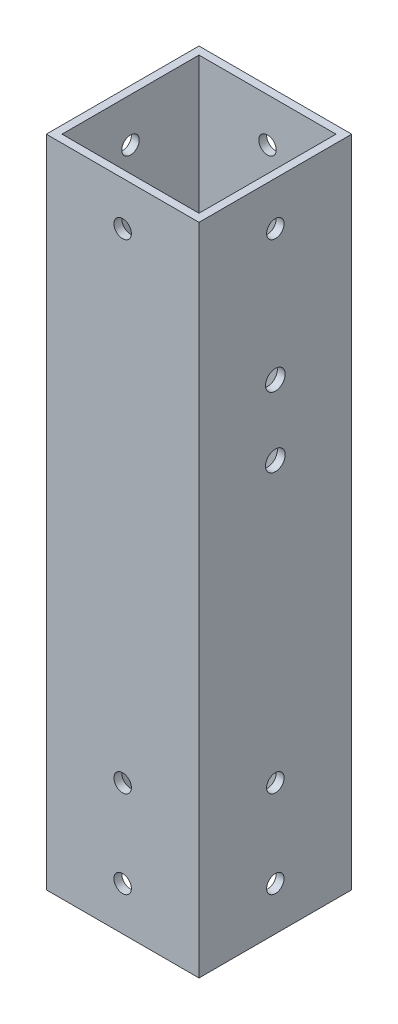
from build123d import *

# Parameters (mm, degrees)
SKETCH1_W           = 35
SKETCH1_H           = 35
SKETCH1_W_2         = 31.4
SKETCH1_H_2         = 31.4
BOSS_EXTRUDE1_DEPTH = 150
SKETCH3_R           = 2
CUT_EXTRUDE1_DEPTH  = 156.020159979
SKETCH4_R           = 2
CUT_EXTRUDE2_DEPTH  = 156.020159979
SKETCH7_R           = 2
CUT_EXTRUDE5_DEPTH  = 40
SKETCH9_R           = 2
CUT_EXTRUDE6_DEPTH  = 40
SKETCH11_R          = 2.25
CUT_EXTRUDE8_DEPTH  = 156.020159979


with BuildPart() as part:
    # Sketch1 → Boss-Extrude1 (new body)
    with BuildSketch(Plane(origin=(0, 0, 0), x_dir=(1, 0, 0), z_dir=(0, 1, 0))):
        Rectangle(SKETCH1_W, SKETCH1_H)
        Rectangle(SKETCH1_W_2, SKETCH1_H_2, mode=Mode.SUBTRACT)
    extrude(amount=BOSS_EXTRUDE1_DEPTH)

    # Sketch3 → Cut-Extrude1 (cut, through all)
    with BuildSketch(Plane.XY.offset(17.5)):
        with Locations((0, 10)):
            Circle(SKETCH3_R)
        with Locations((0, 30)):
            Circle(SKETCH3_R)
    extrude(amount=-CUT_EXTRUDE1_DEPTH, mode=Mode.SUBTRACT)

    # Sketch4 → Cut-Extrude2 (cut, through all)
    with BuildSketch(Plane(origin=(17.5, 0, 0), x_dir=(0, 0, -1), z_dir=(1, 0, 0))):
        with Locations((0, 10)):
            Circle(SKETCH4_R)
        with Locations((0, 30)):
            Circle(SKETCH4_R)
    extrude(amount=-CUT_EXTRUDE2_DEPTH, mode=Mode.SUBTRACT)

    # Sketch7 → Cut-Extrude5 (cut)
    with BuildSketch(Plane(origin=(17.5, 0, 0), x_dir=(0, 0, -1), z_dir=(1, 0, 0))):
        with Locations((0, 140)):
            Circle(SKETCH7_R)
    extrude(amount=-CUT_EXTRUDE5_DEPTH, mode=Mode.SUBTRACT)

    # Sketch9 → Cut-Extrude6 (cut)
    with BuildSketch(Plane.XY.offset(17.5)):
        with Locations((0, 140)):
            Circle(SKETCH9_R)
    extrude(amount=-CUT_EXTRUDE6_DEPTH, mode=Mode.SUBTRACT)

    # Sketch11 → Cut-Extrude8 (cut, through all)
    with BuildSketch(Plane(origin=(17.5, 0, 0), x_dir=(0, 0, -1), z_dir=(1, 0, 0))):
        with Locations((0, 110)):
            Circle(SKETCH11_R)
        with Locations((0, 94)):
            Circle(SKETCH11_R)
    extrude(amount=-CUT_EXTRUDE8_DEPTH, mode=Mode.SUBTRACT)


solid = part.part
